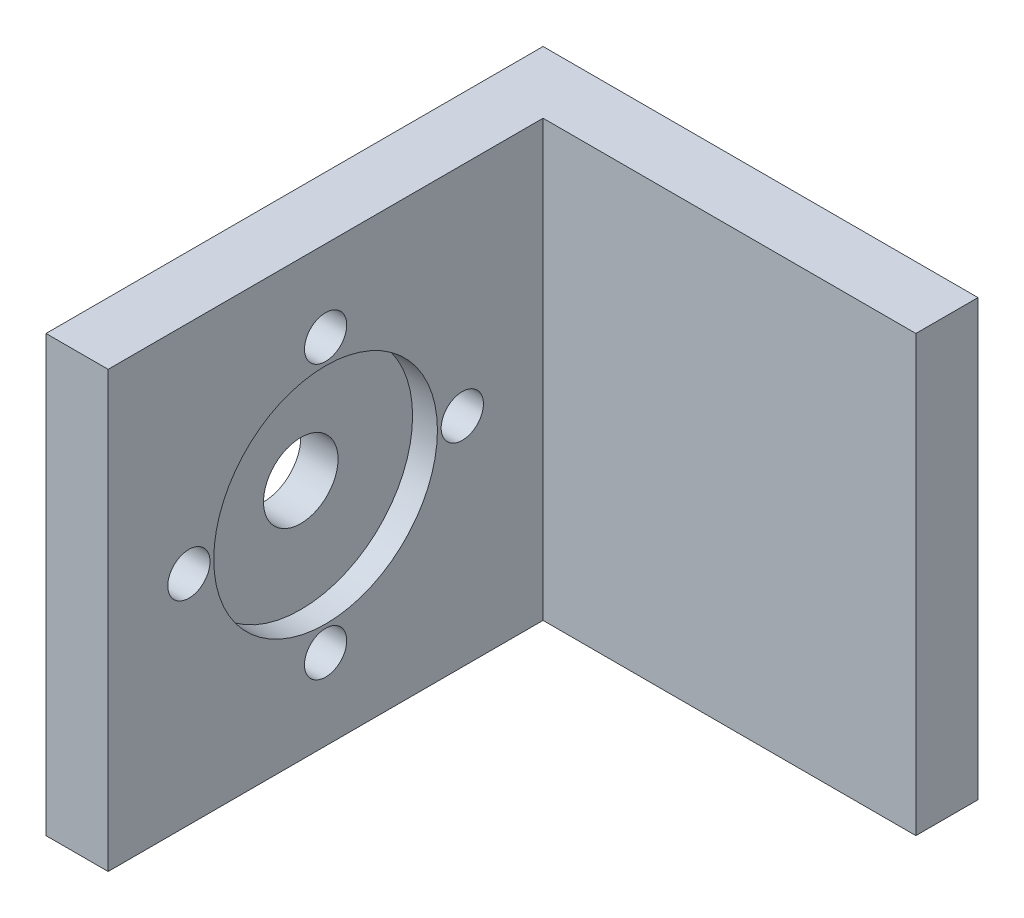
from build123d import *

# Parameters (mm, degrees)
SKETCH3_W           = 35
SKETCH3_H           = 35
BOSS_EXTRUDE1_DEPTH = 5
SKETCH4_R           = 9
CUT_EXTRUDE1_DEPTH  = 2
SKETCH5_R           = 3
CUT_EXTRUDE2_DEPTH  = 25.929901725
SKETCH6_R           = 1.7
CUT_EXTRUDE3_DEPTH  = 26.248762346
SKETCH8_W           = 35
SKETCH8_H           = 35
BOSS_EXTRUDE2_DEPTH = 5


with BuildPart() as part:
    # Sketch3 → Boss-Extrude1 (new body)
    with BuildSketch(Plane.YZ):
        Rectangle(SKETCH3_W, SKETCH3_H)
    extrude(amount=BOSS_EXTRUDE1_DEPTH)

    # Sketch4 → Cut-Extrude1 (cut)
    with BuildSketch(Plane.YZ.offset(5)):
        with Locations(Location((0, 0, 0), (0, 0, 270))):
            Circle(SKETCH4_R)
    extrude(amount=-CUT_EXTRUDE1_DEPTH, mode=Mode.SUBTRACT)

    # Sketch5 → Cut-Extrude2 (cut, through all)
    with BuildSketch(Plane.YZ.offset(3)):
        with Locations(Location((0, 0, 0), (0, 0, 270))):
            Circle(SKETCH5_R)
    extrude(amount=-CUT_EXTRUDE2_DEPTH, mode=Mode.SUBTRACT)

    # Sketch6 → Cut-Extrude3 (cut, through all)
    with BuildSketch(Plane.YZ.offset(5)):
        with Locations(Location((0, 11, 0), (0, 0, 270))):
            Circle(SKETCH6_R)
        with Locations(Location((-11, 0, 0), (0, 0, 270))):
            Circle(SKETCH6_R)
        with Locations(Location((0, -11, 0), (0, 0, 270))):
            Circle(SKETCH6_R)
        with Locations(Location((11, 0, 0), (0, 0, 270))):
            Circle(SKETCH6_R)
    extrude(amount=-CUT_EXTRUDE3_DEPTH, mode=Mode.SUBTRACT)

    # Sketch8 → Boss-Extrude2 (add)
    with BuildSketch(Plane(origin=(0, 0, -17.5), x_dir=(1, 0, 0), z_dir=(0, 0, -1))):
        with Locations((17.5, 0)):
            Rectangle(SKETCH8_W, SKETCH8_H)
    extrude(amount=BOSS_EXTRUDE2_DEPTH)


solid = part.part
